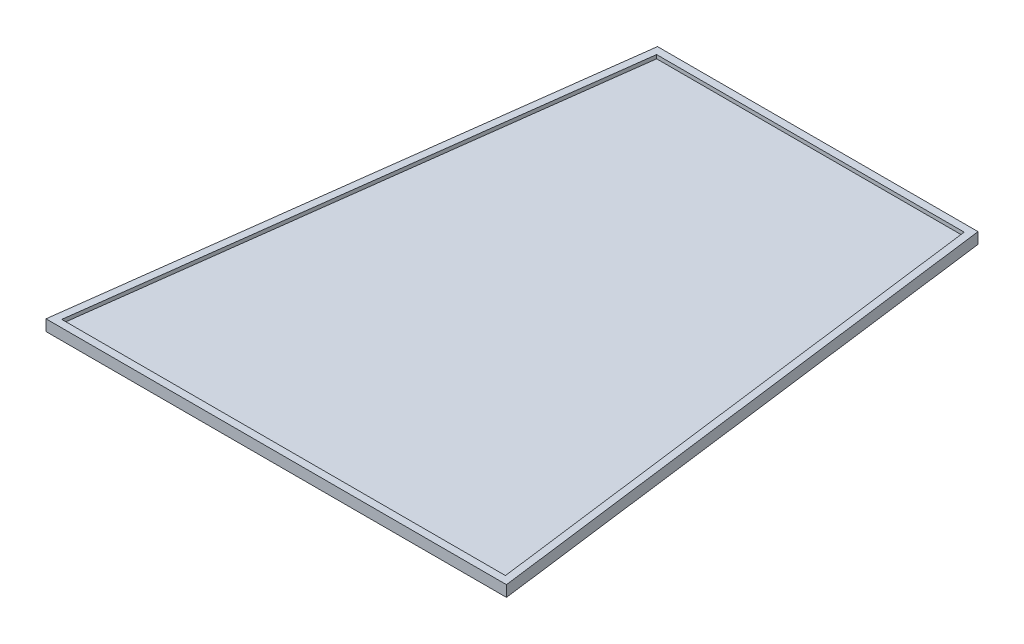
from build123d import *

# Parameters (mm, degrees)
EXTRUDE_1_DEPTH = 1
EXTRUDE_2_DEPTH = 0.5


with BuildPart() as part:
    # 草图1 → 凸台-拉伸1 (new body)
    with BuildSketch(Plane(origin=(0, 0, 0), x_dir=(1, 0, 0), z_dir=(0, 1, 0))):
        Polygon((-31.25, 0), (31.25, 0), (21.75, 73.5), (-21.75, 73.5), align=None)
    extrude(amount=EXTRUDE_1_DEPTH)

    # 草图2 → 凸台-拉伸2 (add)
    with BuildSketch(Plane(origin=(0, 1, 0), x_dir=(1, 0, 0), z_dir=(0, 1, 0))):
        Polygon((-21.75, 73.5), (-31.25, 0), (31.25, 0), (21.75, 73.5), align=None)
        Polygon((-20.870933298, 72.5), (-30.112429896, 1), (30.112429896, 1), (20.870933298, 72.5), align=None, mode=Mode.SUBTRACT)
    extrude(amount=EXTRUDE_2_DEPTH)


solid = part.part
